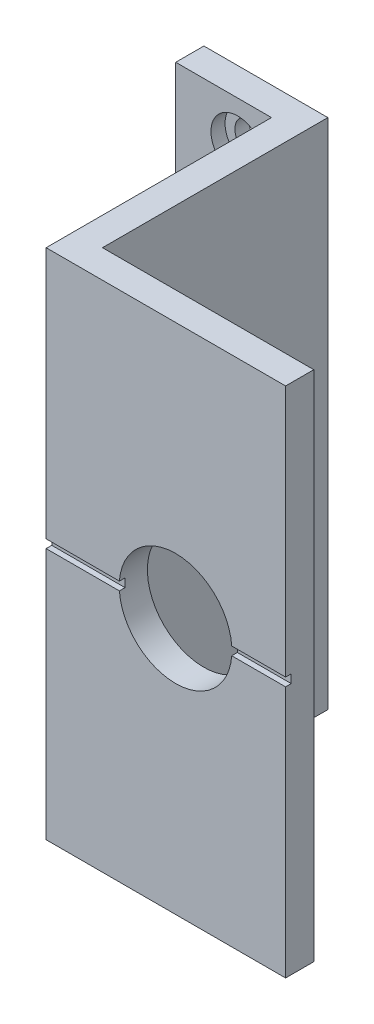
from build123d import *

# Parameters (mm, degrees)
SKETCH_3_W          = 4.4
SKETCH_3_H          = 18.2
EXTRUDE_1_DEPTH     = 1
SKETCH_4_R          = 0.95
CUT_EXTRUDE_1_DEPTH = 0.5
SKETCH_5_W          = 1
SKETCH_5_H          = 18.2
EXTRUDE_2_DEPTH     = 7
SKETCH_6_W          = 8.5
SKETCH_6_H          = 18.2
SKETCH_6_R          = 2
EXTRUDE_3_DEPTH     = 1
SKETCH_8_W          = 8.5
SKETCH_8_H          = 0.3
CUT_EXTRUDE_3_DEPTH = 0.2
SKETCH_9_R          = 0.6
CUT_EXTRUDE_4_DEPTH = 24.107989665
SKETCH_10_W         = 1
SKETCH_10_H         = 5.3
CUT_EXTRUDE_5_DEPTH = 2
FILLET_1_R          = 0.5


with BuildPart() as part:
    # 草圖3 → 填料-伸長1 (new body)
    with BuildSketch(Plane.XY):
        with Locations((3.460771452, 7.885973071)):
            Rectangle(SKETCH_3_W, SKETCH_3_H)
    extrude(amount=EXTRUDE_1_DEPTH)

    # 草圖4 → 除料-伸長1 (cut)
    with BuildSketch(Plane.XY.offset(1)):
        with Locations((3.460771452, 15.485973071)):
            Circle(SKETCH_4_R)
        with Locations((3.460771452, 0.285973071)):
            Circle(SKETCH_4_R)
        with Locations((3.460771452, 12.985973071)):
            Circle(SKETCH_4_R)
        with Locations((3.460771452, 2.785973071)):
            Circle(SKETCH_4_R)
    extrude(amount=-CUT_EXTRUDE_1_DEPTH, mode=Mode.SUBTRACT)

    # 草圖5 → 填料-伸長2 (add)
    with BuildSketch(Plane.XY.offset(1)):
        with Locations((5.160771452, 7.885973071)):
            Rectangle(SKETCH_5_W, SKETCH_5_H)
    extrude(amount=EXTRUDE_2_DEPTH)

    # 草圖6 → 填料-伸長3 (add)
    with BuildSketch(Plane.XY.offset(8)):
        with Locations((8.910771452, 7.885973071)):
            Rectangle(SKETCH_6_W, SKETCH_6_H)
        with Locations((9.254845598, 7.885973071)):
            Circle(SKETCH_6_R, mode=Mode.SUBTRACT)
    extrude(amount=EXTRUDE_3_DEPTH)

    # 草圖8 → 除料-伸長3 (cut)
    with BuildSketch(Plane.XY.offset(9)):
        with Locations((8.910771452, 7.885973071)):
            Rectangle(SKETCH_8_W, SKETCH_8_H)
    extrude(amount=-CUT_EXTRUDE_3_DEPTH, mode=Mode.SUBTRACT)

    # 草圖9 → 除料-伸長4 (cut, through all)
    with BuildSketch(Plane.XY.offset(0.5)):
        with Locations((3.460771452, 15.485973071)):
            Circle(SKETCH_9_R)
        with Locations((3.460771452, 12.985973071)):
            Circle(SKETCH_9_R)
        with Locations((3.460771452, 2.785973071)):
            Circle(SKETCH_9_R)
        with Locations((3.460771452, 0.285973071)):
            Circle(SKETCH_9_R)
    extrude(amount=-CUT_EXTRUDE_4_DEPTH, mode=Mode.SUBTRACT)

    # 草圖10 → 除料-伸長5 (cut)
    with BuildSketch(Plane.ZY.offset(-1.260771452)):
        with Locations((0.5, 7.885973071)):
            Rectangle(SKETCH_10_W, SKETCH_10_H)
    extrude(amount=-CUT_EXTRUDE_5_DEPTH, mode=Mode.SUBTRACT)

    # 圓角1
    fillet_1_edges = [part.edges().sort_by_distance(p)[0] for p in [
        (3.260771452, 5.235973071, 0.5),
        (3.260771452, 10.535973071, 0.5),
    ]]
    fillet(fillet_1_edges, radius=FILLET_1_R)


solid = part.part
